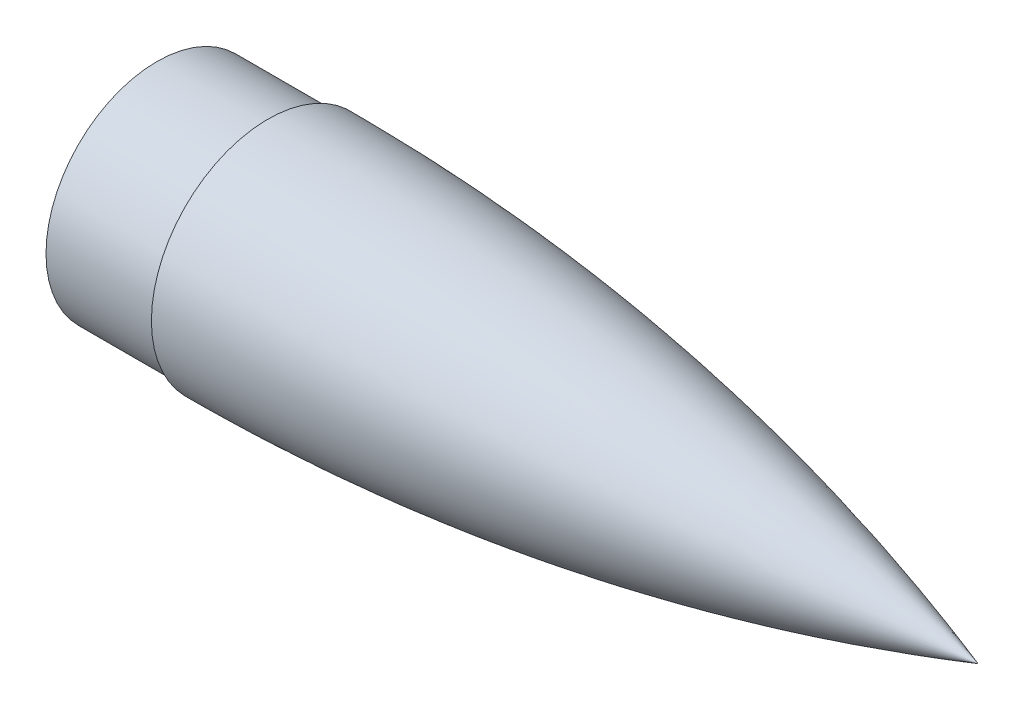
from build123d import *


with BuildPart() as part:
    # Sketch2 → Revolve2 (revolve)
    with BuildSketch(Plane(origin=(0, 0, 0), x_dir=(1, 0, 0), z_dir=(0, 1, 0)), mode=Mode.PRIVATE) as revolve2_sk:
        with BuildLine():
            Line((63.5, 63.5), (0, 63.5))
            Line((0, 63.5), (0, 60.325))
            Line((0, 60.325), (66.675, 60.325))
            Line((66.675, 60.325), (66.675, 63.496027224))
            ThreePointArc((66.675, 63.496027224), (265.770362529, 47.272304448), (459.851535737, 0))
            Line((459.851535737, 0), (469.9, 0))
            ThreePointArc((469.9, 0), (269.416558116, 49.895568515), (63.5, 66.675))
            Line((63.5, 66.675), (63.5, 63.5))
        make_face()
    revolve(revolve2_sk.sketch.rotate(Axis((0, 0, 0), (1, 0, 0)), 180), axis=Axis((0, 0, 0), (1, 0, 0)))


solid = part.part
